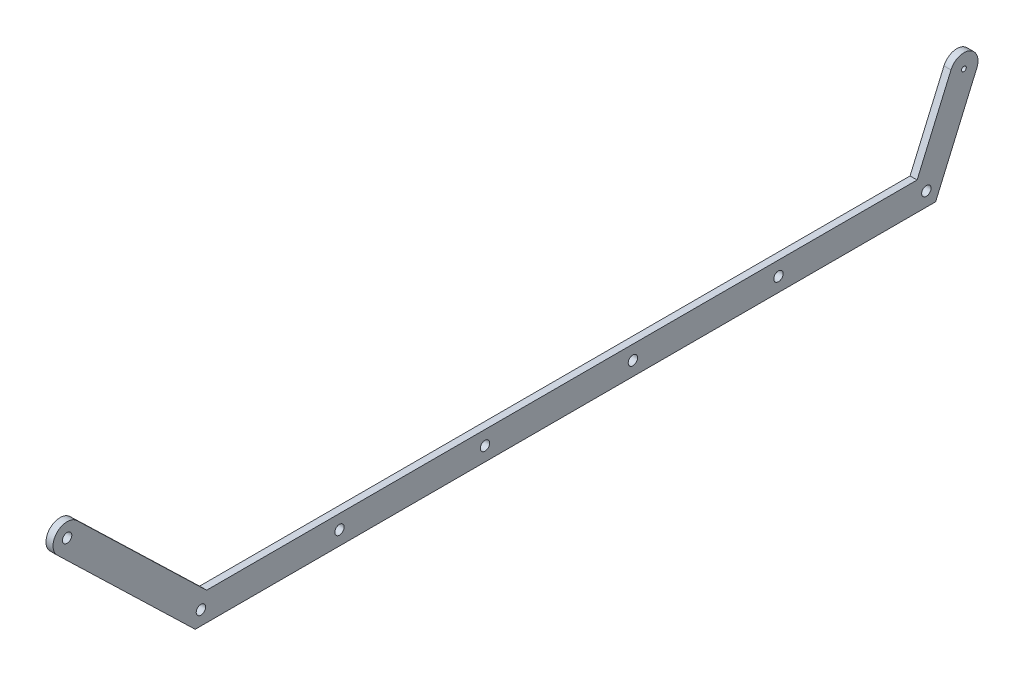
from build123d import *

# Parameters (mm, degrees)
SKETCH1_R           = 1
SKETCH1_R_2         = 2
BOSS_EXTRUDE1_DEPTH = 3


with BuildPart() as part:
    # Sketch1 → Boss-Extrude1 (new body)
    with BuildSketch(Plane(origin=(0, 0, 0), x_dir=(0, 0, -1), z_dir=(1, 0, 0))):
        with BuildLine():
            ThreePointArc((376.492857784, -15.618533096), (384.381466904, -12.492857784), (387.507142216, -20.381466904))
            Line((387.507142216, -20.381466904), (369.942371147, -61))
            Line((369.942371147, -61), (366, -61))
            Line((366, -61), (54.561190838, -61))
            Line((54.561190838, -61), (-4.166215043, -4.317713772))
            ThreePointArc((-4.166215043, -4.317713772), (-4.317713772, 4.166215043), (4.166215043, 4.317713772))
            Line((4.166215043, 4.317713772), (59.42275477, -49))
            Line((59.42275477, -49), (362.057628853, -49))
            Line((362.057628853, -49), (376.492857784, -15.618533096))
        make_face()
        with Locations((382, -18)):
            Circle(SKETCH1_R, mode=Mode.SUBTRACT)
        with Locations((366, -55)):
            Circle(SKETCH1_R_2, mode=Mode.SUBTRACT)
        with Locations((303, -55)):
            Circle(SKETCH1_R_2, mode=Mode.SUBTRACT)
        with Locations((241, -55)):
            Circle(SKETCH1_R_2, mode=Mode.SUBTRACT)
        with Locations((178, -55)):
            Circle(SKETCH1_R_2, mode=Mode.SUBTRACT)
        with Locations((116, -55)):
            Circle(SKETCH1_R_2, mode=Mode.SUBTRACT)
        with Locations((57, -55)):
            Circle(SKETCH1_R_2, mode=Mode.SUBTRACT)
        Circle(SKETCH1_R_2, mode=Mode.SUBTRACT)
    extrude(amount=BOSS_EXTRUDE1_DEPTH)


solid = part.part
